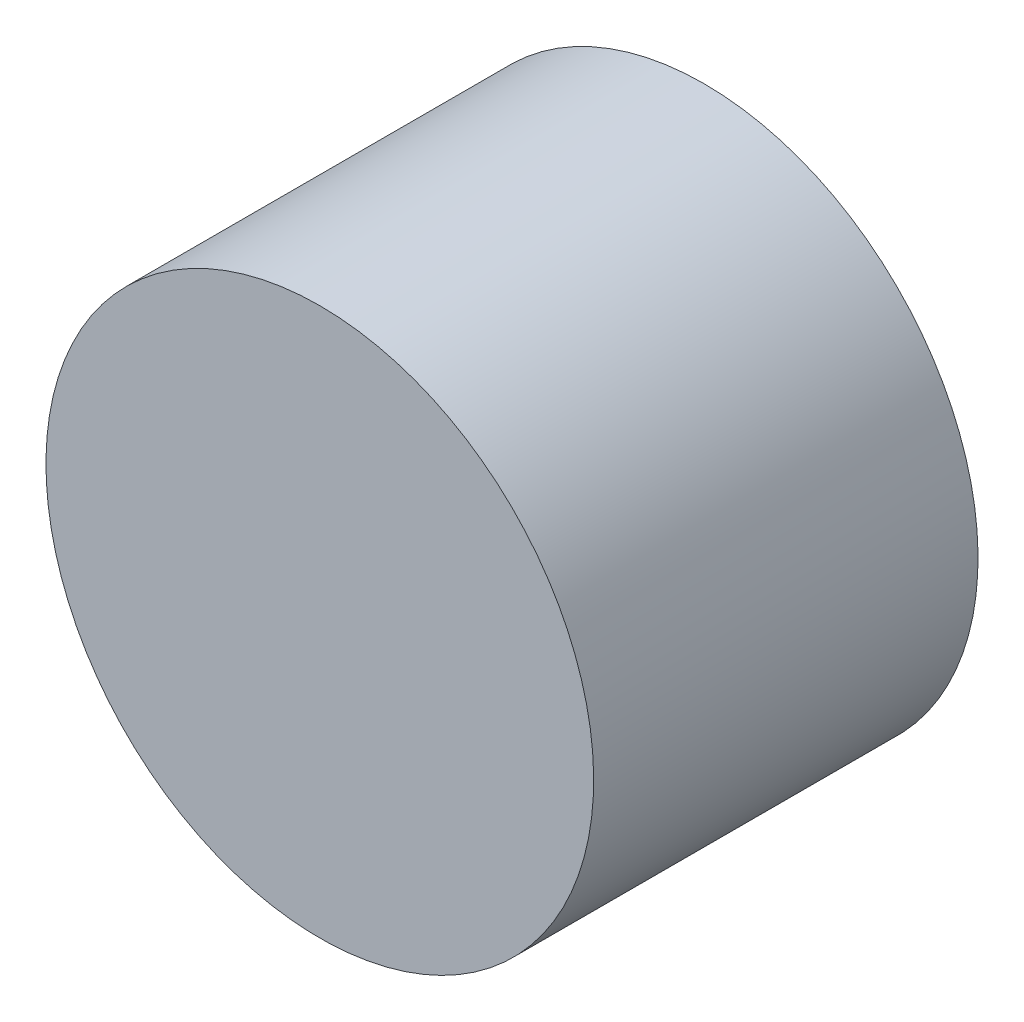
from build123d import *


with BuildPart() as part:
    # Esquisse1 → Révolution1 (revolve)
    with BuildSketch(Plane(origin=(0, 0, 0), x_dir=(0, 0, -1), z_dir=(1, 0, 0))):
        Polygon((-40, 0), (-40, 28.5), (0, 28.5), (0, 13.5), (-28, 13.5), (-28, 0), align=None)
    revolve(axis=Axis((0, 0, 28), (0, 0, 1)))


solid = part.part
